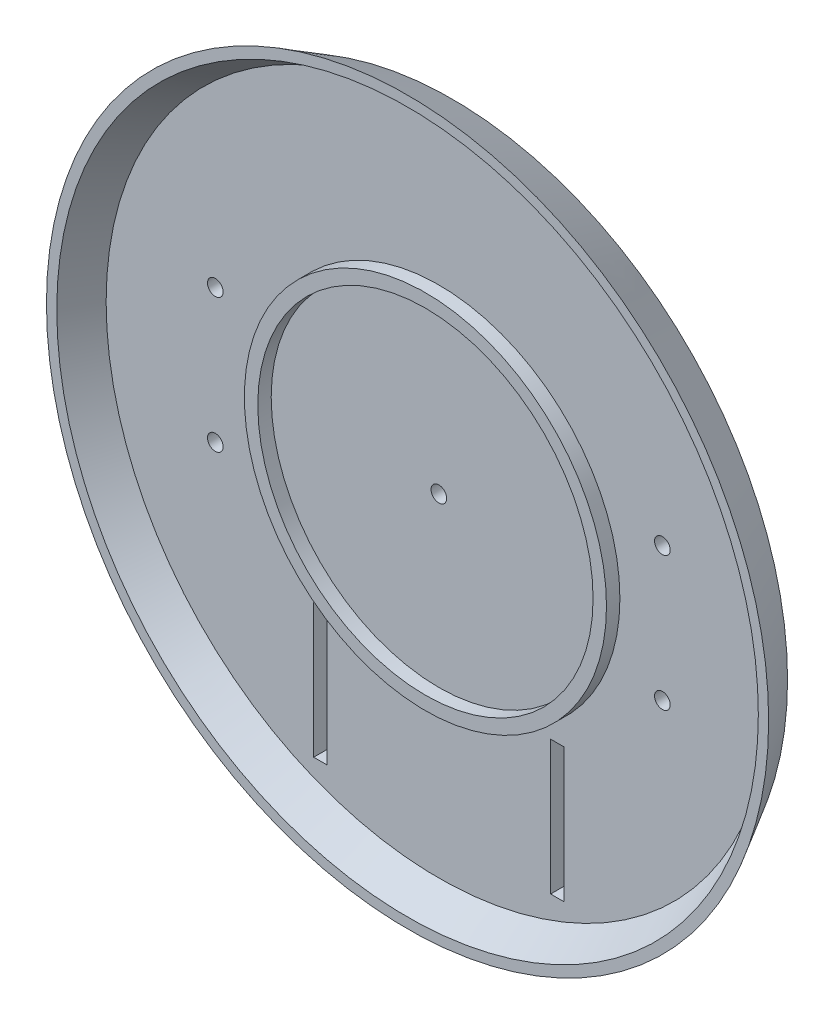
from build123d import *

# Parameters (mm, degrees)
SKETCH1_R           = 75
BOSS_EXTRUDE1_DEPTH = 3
SKETCH2_R           = 1.75
CUT_EXTRUDE1_DEPTH  = 107.108435103
SKETCH3_R           = 40.5
SKETCH3_R_2         = 37.5
BOSS_EXTRUDE2_DEPTH = 3
SKETCH4_W           = 3
SKETCH4_H           = 30
CUT_EXTRUDE2_DEPTH  = 107.235587258


with BuildPart() as part:
    # Sketch1 → Boss-Extrude1 (new body)
    with BuildSketch(Plane.XY):
        Circle(SKETCH1_R)
    extrude(amount=BOSS_EXTRUDE1_DEPTH)

    # Sketch2 → Cut-Extrude1 (cut, through all)
    with BuildSketch(Plane.XY.offset(3)):
        with Locations((-50, 15)):
            Circle(SKETCH2_R)
        with Locations((-50, -15)):
            Circle(SKETCH2_R)
        with Locations((50, -15)):
            Circle(SKETCH2_R)
        with Locations((50, 15)):
            Circle(SKETCH2_R)
        Circle(SKETCH2_R)
    extrude(amount=-CUT_EXTRUDE1_DEPTH, mode=Mode.SUBTRACT)

    # Sketch3 → Boss-Extrude2 (add)
    with BuildSketch(Plane.XY.offset(3)):
        Circle(SKETCH3_R)
        Circle(SKETCH3_R_2, mode=Mode.SUBTRACT)
    extrude(amount=BOSS_EXTRUDE2_DEPTH)

    # Sketch4 → Cut-Extrude2 (cut, through all)
    with BuildSketch(Plane(origin=(0, 0, 0), x_dir=(-1, 0, 0), z_dir=(0, 0, -1))):
        with Locations((-26.5, -50)):
            Rectangle(SKETCH4_W, SKETCH4_H)
        with Locations((26.5, -50)):
            Rectangle(SKETCH4_W, SKETCH4_H)
    extrude(amount=-CUT_EXTRUDE2_DEPTH, mode=Mode.SUBTRACT)

    # Sketch5 → Revolve1 (revolve)
    with BuildSketch(Plane(origin=(0, 0, 0), x_dir=(1, 0, 0), z_dir=(0, 1, 0)), mode=Mode.PRIVATE) as revolve1_sk:
        Polygon((-75, 0), (-80.773502692, -10), (-78.464101615, -10), (-72.690598923, 0), align=None)
    revolve(revolve1_sk.sketch.rotate(Axis((0, 0, 0), (0, 0, 1)), 180), axis=Axis((0, 0, 0), (0, 0, 1)))


solid = part.part
